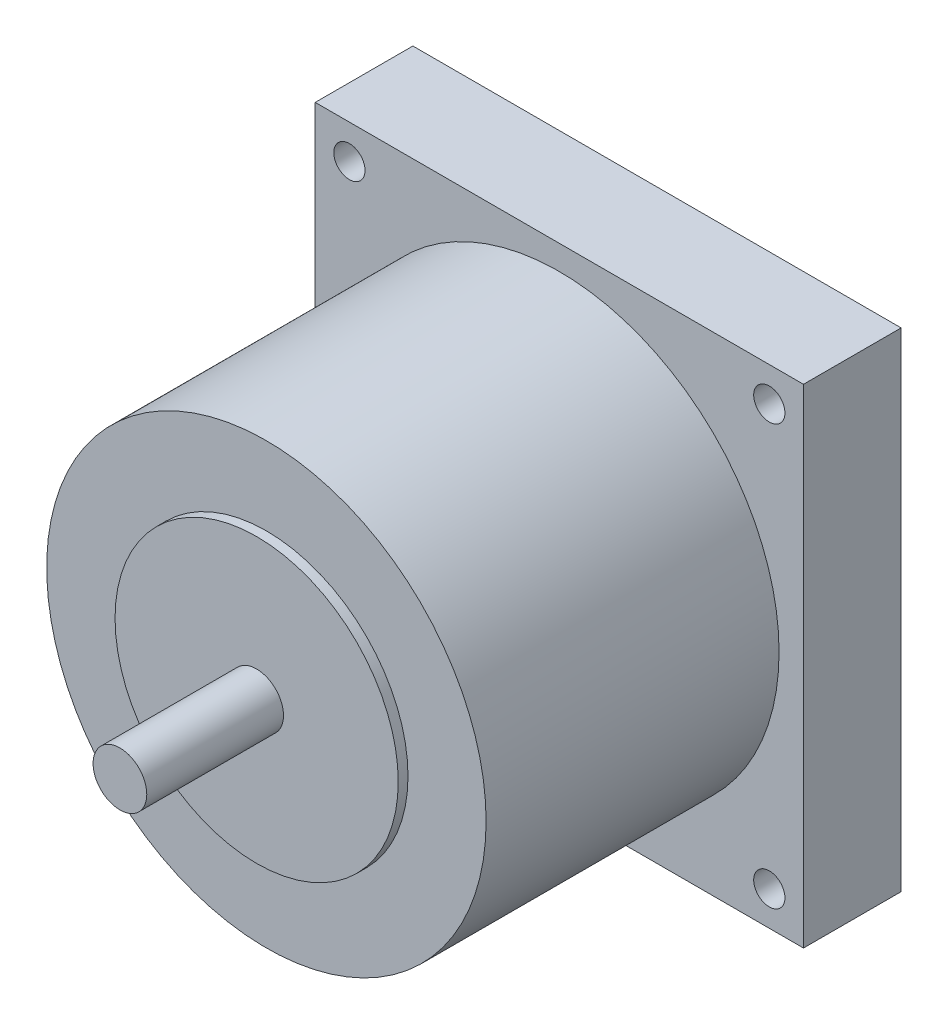
from build123d import *

# Parameters (mm, degrees)
SKETCH2_W           = 50
SKETCH2_H           = 50
BOSS_EXTRUDE1_DEPTH = 10
SKETCH2_3_R         = 22.5
BOSS_EXTRUDE2_DEPTH = 40
SKETCH2_4_R         = 14.5
SKETCH2_4_R_2       = 2.75
BOSS_EXTRUDE3_DEPTH = 41
SKETCH2_5_R         = 2.75
BOSS_EXTRUDE4_DEPTH = 55
SKETCH4_R           = 1.6
CUT_EXTRUDE1_DEPTH  = 66.383484153


with BuildPart() as part:
    # Sketch2 → Boss-Extrude1 (new body)
    with BuildSketch(Plane.XY):
        Rectangle(SKETCH2_W, SKETCH2_H)
    extrude(amount=BOSS_EXTRUDE1_DEPTH)

    # Sketch2<3> → Boss-Extrude2 (add)
    with BuildSketch(Plane.XY):
        Circle(SKETCH2_3_R)
    extrude(amount=BOSS_EXTRUDE2_DEPTH)

    # Sketch2<4> → Boss-Extrude3 (add)
    with BuildSketch(Plane.XY):
        Circle(SKETCH2_4_R)
        Circle(SKETCH2_4_R_2, mode=Mode.SUBTRACT)
    extrude(amount=BOSS_EXTRUDE3_DEPTH)

    # Sketch2<5> → Boss-Extrude4 (add)
    with BuildSketch(Plane.XY):
        Circle(SKETCH2_5_R)
    extrude(amount=BOSS_EXTRUDE4_DEPTH)

    # Sketch4 → Cut-Extrude1 (cut, through all)
    with BuildSketch(Plane(origin=(0, 0, 0), x_dir=(-1, 0, 0), z_dir=(0, 0, -1))):
        with Locations((-21.5, 21.5)):
            Circle(SKETCH4_R)
        with Locations((-21.5, -21.5)):
            Circle(SKETCH4_R)
        with Locations((21.5, -21.5)):
            Circle(SKETCH4_R)
        with Locations((21.5, 21.5)):
            Circle(SKETCH4_R)
    extrude(amount=-CUT_EXTRUDE1_DEPTH, mode=Mode.SUBTRACT)


solid = part.part
